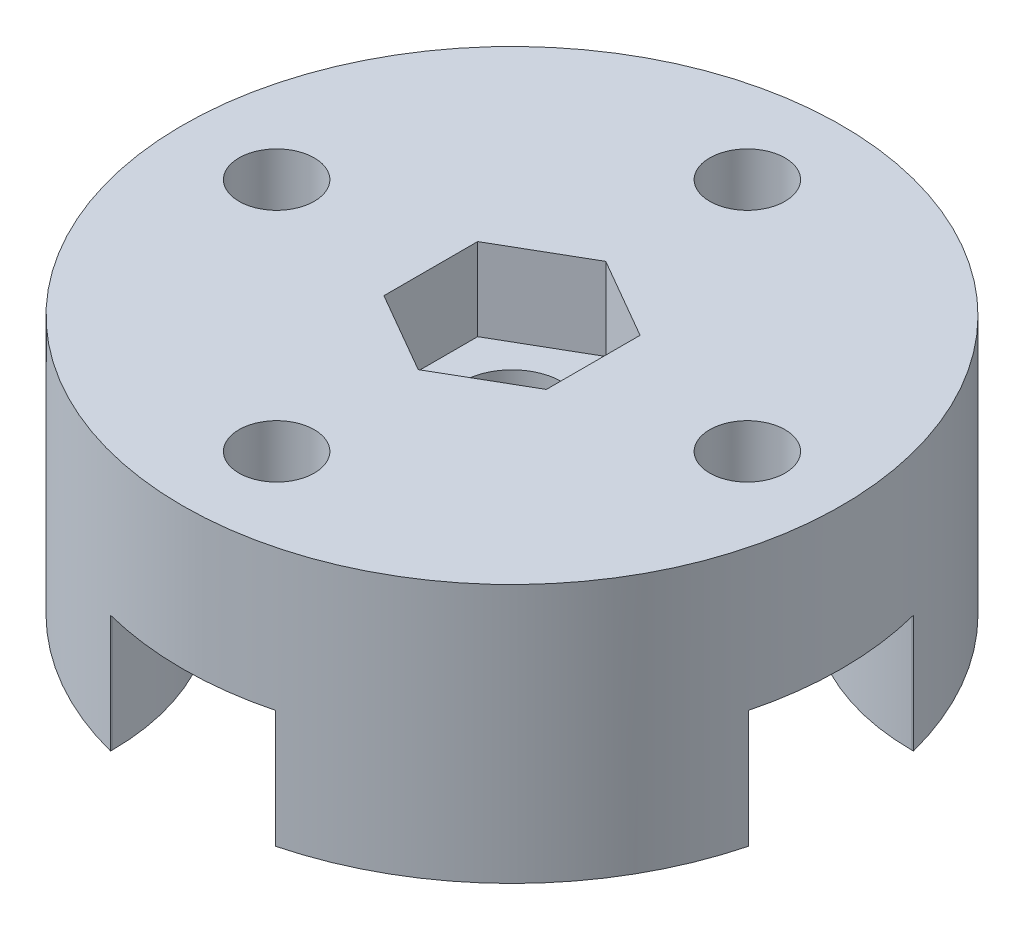
from build123d import *

# Parameters (mm, degrees)
SKETCH1_R           = 14
SKETCH1_R_2         = 1.6
BOSS_EXTRUDE1_DEPTH = 3.5
BOSS_EXTRUDE2_START = 2.5
SKETCH2_R           = 14
SKETCH2_R_2         = 2.125
SKETCH2_R_3         = 1.6
BOSS_EXTRUDE2_DEPTH = 2.5
CHAMFER1_SIZE       = 1.5
BOSS_EXTRUDE3_START = 5
BOSS_EXTRUDE3_DEPTH = 5
FILLET1_R           = 10


with BuildPart() as part:
    # Sketch1 → Boss-Extrude1 (new body)
    with BuildSketch(Plane(origin=(0, 0, 0), x_dir=(1, 0, 0), z_dir=(0, 1, 0))):
        with Locations(Location((0, 0, 0), (0, 0, 270))):
            Circle(SKETCH1_R)
        with Locations(Location((0, 10, 0), (0, 0, 270))):
            Circle(SKETCH1_R_2, mode=Mode.SUBTRACT)
        with Locations(Location((10, 0, 0), (0, 0, 270))):
            Circle(SKETCH1_R_2, mode=Mode.SUBTRACT)
        with Locations(Location((0, -10, 0), (0, 0, 270))):
            Circle(SKETCH1_R_2, mode=Mode.SUBTRACT)
        with Locations(Location((-10, 0, 0), (0, 0, 270))):
            Circle(SKETCH1_R_2, mode=Mode.SUBTRACT)
        Polygon((0, 3.983716857), (-3.45, 1.991858429), (-3.45, -1.991858429), (0, -3.983716857), (3.45, -1.991858429), (3.45, 1.991858429), align=None, mode=Mode.SUBTRACT)
    extrude(amount=BOSS_EXTRUDE1_DEPTH)

    # Sketch2 → Boss-Extrude2 (add)
    with BuildSketch(Plane.XZ.offset(BOSS_EXTRUDE2_START)):
        with Locations(Location((0, 0, 0), (0, 0, 270))):
            Circle(SKETCH2_R)
        with Locations(Location((0, 0, 0), (0, 0, 270))):
            Circle(SKETCH2_R_2, mode=Mode.SUBTRACT)
        with Locations(Location((10, 0, 0), (0, 0, 270))):
            Circle(SKETCH2_R_3, mode=Mode.SUBTRACT)
        with Locations(Location((0, -10, 0), (0, 0, 270))):
            Circle(SKETCH2_R_3, mode=Mode.SUBTRACT)
        with Locations(Location((-10, 0, 0), (0, 0, 270))):
            Circle(SKETCH2_R_3, mode=Mode.SUBTRACT)
        with Locations(Location((0, 10, 0), (0, 0, 270))):
            Circle(SKETCH2_R_3, mode=Mode.SUBTRACT)
    extrude(amount=-BOSS_EXTRUDE2_DEPTH)

    # Chamfer1
    chamfer1_edges = [part.edges().sort_by_distance(p)[0] for p in [
        (0, -2.5, 2.125),
        (10, -2.5, 1.6),
        (0, -2.5, -8.4),
        (-10, -2.5, 1.6),
        (0, -2.5, 11.6),
    ]]
    chamfer(chamfer1_edges, length=CHAMFER1_SIZE)

    # Sketch3 → Boss-Extrude3 (add)
    with BuildSketch(Plane.XZ.offset(2.5).offset(BOSS_EXTRUDE3_START)):
        with BuildLine():
            ThreePointArc((-3.5, 13.555441712), (-9.899494937, 9.899494937), (-13.555441712, 3.5))
            Line((-13.555441712, 3.5), (-4, 3.5))
            Line((-4, 3.5), (-3.5, 3.5))
            Line((-3.5, 3.5), (-3.5, 4))
            Line((-3.5, 4), (-3.5, 13.555441712))
        make_face()
        with BuildLine():
            Line((4, 3.5), (13.555441712, 3.5))
            ThreePointArc((13.555441712, 3.5), (9.899494937, 9.899494937), (3.5, 13.555441712))
            Line((3.5, 13.555441712), (3.5, 4))
            Line((3.5, 4), (3.5, 3.5))
            Line((3.5, 3.5), (4, 3.5))
        make_face()
        with BuildLine():
            Line((13.555441712, -3.5), (4, -3.5))
            Line((4, -3.5), (3.5, -3.5))
            Line((3.5, -3.5), (3.5, -4))
            Line((3.5, -4), (3.5, -13.555441712))
            ThreePointArc((3.5, -13.555441712), (9.899494937, -9.899494937), (13.555441712, -3.5))
        make_face()
        with BuildLine():
            ThreePointArc((-13.555441712, -3.5), (-9.899494937, -9.899494937), (-3.5, -13.555441712))
            Line((-3.5, -13.555441712), (-3.5, -4))
            Line((-3.5, -4), (-3.5, -3.5))
            Line((-3.5, -3.5), (-4, -3.5))
            Line((-4, -3.5), (-13.555441712, -3.5))
        make_face()
    extrude(amount=-BOSS_EXTRUDE3_DEPTH)

    # Fillet1
    fillet1_edges = [part.edges().sort_by_distance(p)[0] for p in [
        (-3.5, -5, 3.5),
        (-3.5, -5, -3.5),
        (3.5, -5, -3.5),
        (3.5, -5, 3.5),
    ]]
    fillet(fillet1_edges, radius=FILLET1_R)


solid = part.part
